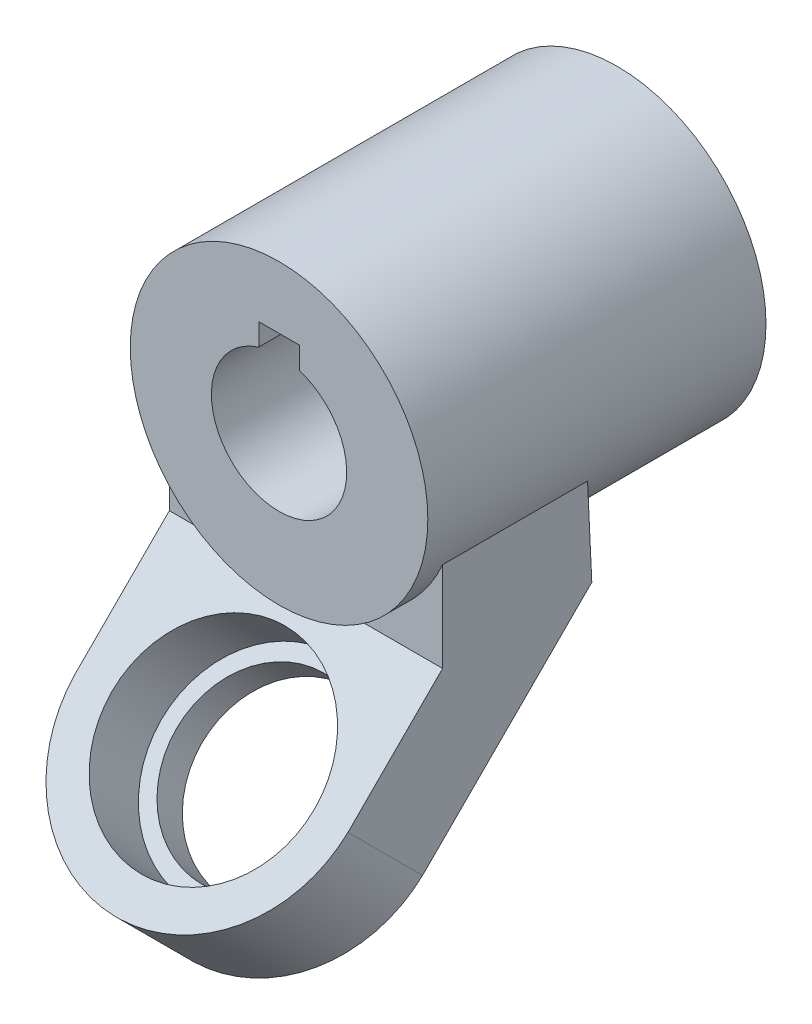
from build123d import *

# Parameters (mm, degrees)
BOSS_EXTRU_1_DEPTH      = 25
BOSS_EXTRU_1_DEPTH_BACK = 25
ESQUISSE1_R             = 22
BOSS_EXTRU_2_DEPTH      = 20.2
BOSS_EXTRU_2_DEPTH_BACK = 20.2
ESQUISSE5_R             = 15
ENL_V_MAT_EXTRU_1_DEPTH = 10.3
ESQUISSE7_R             = 12.75
ENL_V_MAT_EXTRU_3_DEPTH = 82.218329674
ESQUISSE8_R             = 10
ENL_V_MAT_EXTRU_4_DEPTH = 82.89474471
ESQUISSE9_R             = 18
ENL_V_MAT_EXTRU_5_DEPTH = 2
ENL_V_MAT_EXTRU_6_DEPTH = 82.218329674


with BuildPart() as part:
    # Esquisse1 → Boss.-Extru.1 (new, two sides: drawn at the far end of the back side and taken through both)
    with BuildSketch(Plane.XY.offset(-BOSS_EXTRU_1_DEPTH_BACK)):
        Circle(ESQUISSE1_R)
        with BuildLine():
            Line((-3, 9.539392014), (-3, 12.8))
            Line((-3, 12.8), (3, 12.8))
            Line((3, 12.8), (3, 9.539392014))
            ThreePointArc((3, 9.539392014), (8.062257748, 5.916079783), (10, 0))
            ThreePointArc((10, 0), (-5.916079783, -8.062257748), (-3, 9.539392014))
        make_face(mode=Mode.SUBTRACT)
    extrude(amount=BOSS_EXTRU_1_DEPTH + BOSS_EXTRU_1_DEPTH_BACK)

    # Esquisse4 → Boss.-Extru.2 (add, two sides: drawn at the far end of the back side and taken through both)
    with BuildSketch(Plane(origin=(0, 0, 0), x_dir=(0, 0, -1), z_dir=(1, 0, 0)).offset(-BOSS_EXTRU_2_DEPTH_BACK)):
        Polygon((1.045201898, -22), (-37.969134213, -61.014336111), (-49, -49.983470325), (-21.016529675, -22), (-21.016529675, 0), (0, 0), align=None)
    extrude(amount=BOSS_EXTRU_2_DEPTH + BOSS_EXTRU_2_DEPTH_BACK)

    # Esquisse5 → Enlèv. mat.-Extru.1 (cut)
    with BuildSketch(Plane(origin=(0, -0.491735162, -0.491735162), x_dir=(1, 0, 0), z_dir=(0, 0.7071067811865487, 0.7071067811865465))):
        with Locations((0, -49.791883092)):
            Circle(ESQUISSE5_R)
    extrude(amount=-ENL_V_MAT_EXTRU_1_DEPTH, mode=Mode.SUBTRACT)

    # Esquisse7 → Enlèv. mat.-Extru.3 (cut, through all)
    with BuildSketch(Plane(origin=(0, -0.491735162, -0.491735162), x_dir=(1, 0, 0), z_dir=(0, 0.7071067811865487, 0.7071067811865465))):
        with Locations((0, -49.791883092)):
            Circle(ESQUISSE7_R)
    extrude(amount=-ENL_V_MAT_EXTRU_3_DEPTH, mode=Mode.SUBTRACT)

    # Esquisse8 → Enlèv. mat.-Extru.4 (cut, through all)
    with BuildSketch(Plane.XY.offset(25)):
        Circle(ESQUISSE8_R)
    extrude(amount=-ENL_V_MAT_EXTRU_4_DEPTH, mode=Mode.SUBTRACT)

    # Esquisse9 → Enlèv. mat.-Extru.5 (cut)
    with BuildSketch(Plane(origin=(0, 0, -25), x_dir=(-1, 0, 0), z_dir=(0, 0, -1))):
        Circle(ESQUISSE9_R)
    extrude(amount=-ENL_V_MAT_EXTRU_5_DEPTH, mode=Mode.SUBTRACT)

    # Esquisse11 → Enlèv. mat.-Extru.6 (cut, through all)
    with BuildSketch(Plane(origin=(0, -0.491735162, -0.491735162), x_dir=(1, 0, 0), z_dir=(0, 0.7071067811865487, 0.7071067811865465))):
        with BuildLine():
            ThreePointArc((-0.412698372, -69.991883092), (-14.286537718, -64.07842081), (-20.2, -50.204581464))
            Line((-20.2, -50.204581464), (-20.2, -69.991883092))
            Line((-20.2, -69.991883092), (-0.412698372, -69.991883092))
        make_face()
        with BuildLine():
            ThreePointArc((20.2, -50.204581464), (14.286537718, -64.07842081), (0.412698372, -69.991883092))
            Line((0.412698372, -69.991883092), (20.2, -69.991883092))
            Line((20.2, -69.991883092), (20.2, -50.204581464))
        make_face()
    extrude(amount=-ENL_V_MAT_EXTRU_6_DEPTH, mode=Mode.SUBTRACT)


solid = part.part
